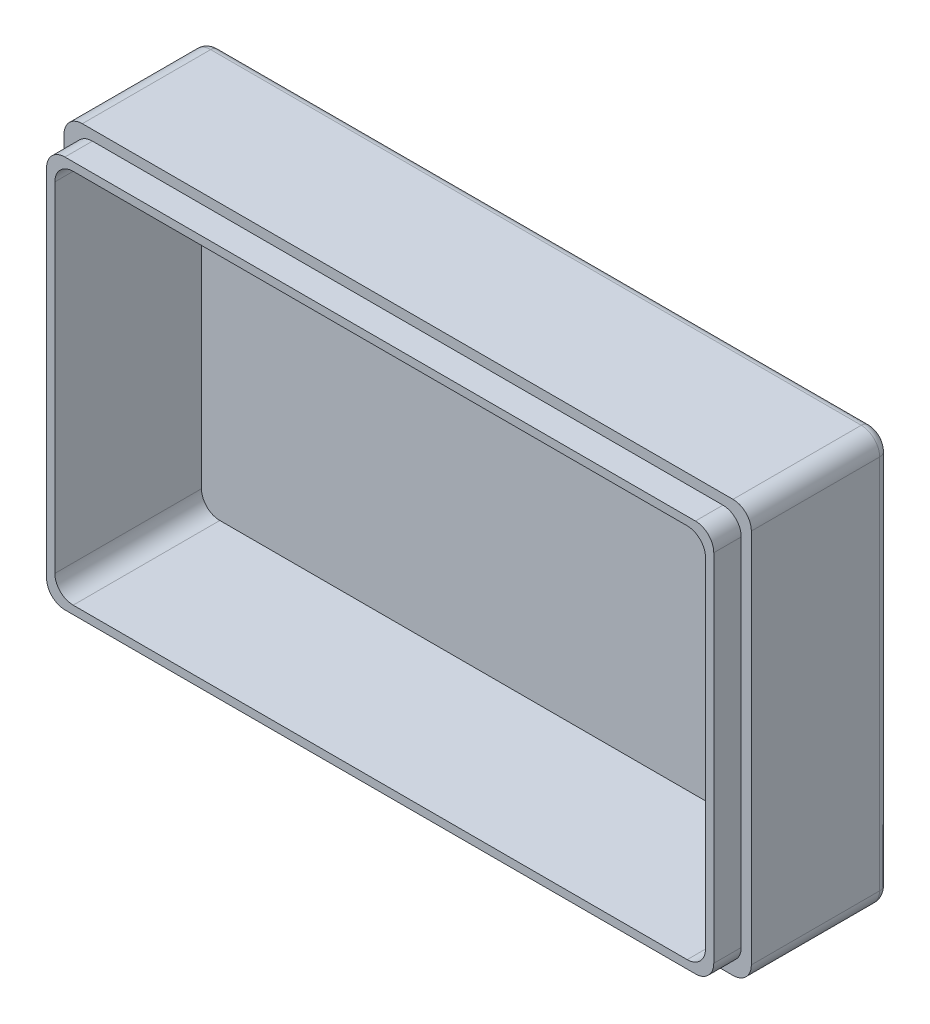
from build123d import *

# Parameters (mm, degrees)
SKETCH_1_W          = 75
SKETCH_1_H          = 45
EXTRUDE_1_DEPTH     = 18
SKETCH_2_W          = 71
SKETCH_2_H          = 41
CUT_EXTRUDE_1_DEPTH = 16
SKETCH_3_W          = 75
SKETCH_3_H          = 45
SKETCH_3_W_2        = 72.8
SKETCH_3_H_2        = 42.8
CUT_EXTRUDE_2_DEPTH = 3
FILLET_1_R          = 2
FILLET_2_R          = 1


with BuildPart() as part:
    # 草图1 → 凸台-拉伸1 (new body)
    with BuildSketch(Plane.XY):
        Rectangle(SKETCH_1_W, SKETCH_1_H)
    extrude(amount=EXTRUDE_1_DEPTH)

    # 草图2 → 切除-拉伸1 (cut)
    with BuildSketch(Plane.XY.offset(18)):
        Rectangle(SKETCH_2_W, SKETCH_2_H)
    extrude(amount=-CUT_EXTRUDE_1_DEPTH, mode=Mode.SUBTRACT)

    # 草图3 → 切除-拉伸2 (cut)
    with BuildSketch(Plane.XY.offset(18)):
        Rectangle(SKETCH_3_W, SKETCH_3_H)
        Rectangle(SKETCH_3_W_2, SKETCH_3_H_2, mode=Mode.SUBTRACT)
    extrude(amount=-CUT_EXTRUDE_2_DEPTH, mode=Mode.SUBTRACT)

    # 圆角1
    fillet_1_edges = [part.edges().sort_by_distance(p)[0] for p in [
        (-35.5, 20.5, 10),
        (35.5, 20.5, 10),
        (35.5, -20.5, 10),
        (-35.5, -20.5, 10),
        (-37.5, 22.5, 7.5),
        (37.5, 22.5, 7.5),
        (37.5, -22.5, 7.5),
        (-37.5, -22.5, 7.5),
        (-36.4, 21.4, 16.5),
        (36.4, 21.4, 16.5),
        (36.4, -21.4, 16.5),
        (-36.4, -21.4, 16.5),
    ]]
    fillet(fillet_1_edges, radius=FILLET_1_R)

    # 圆角2
    fillet_2_edges = [part.edges().sort_by_distance(p)[0] for p in [
        (0, 22.5, 0),
        (-37.5, 0, 0),
        (37.5, 0, 0),
        (0, -22.5, 0),
        (-36.914213562, 21.914213562, 0),
        (-36.914213562, -21.914213562, 0),
        (36.914213562, -21.914213562, 0),
        (36.914213562, 21.914213562, 0),
    ]]
    fillet(fillet_2_edges, radius=FILLET_2_R)


solid = part.part
